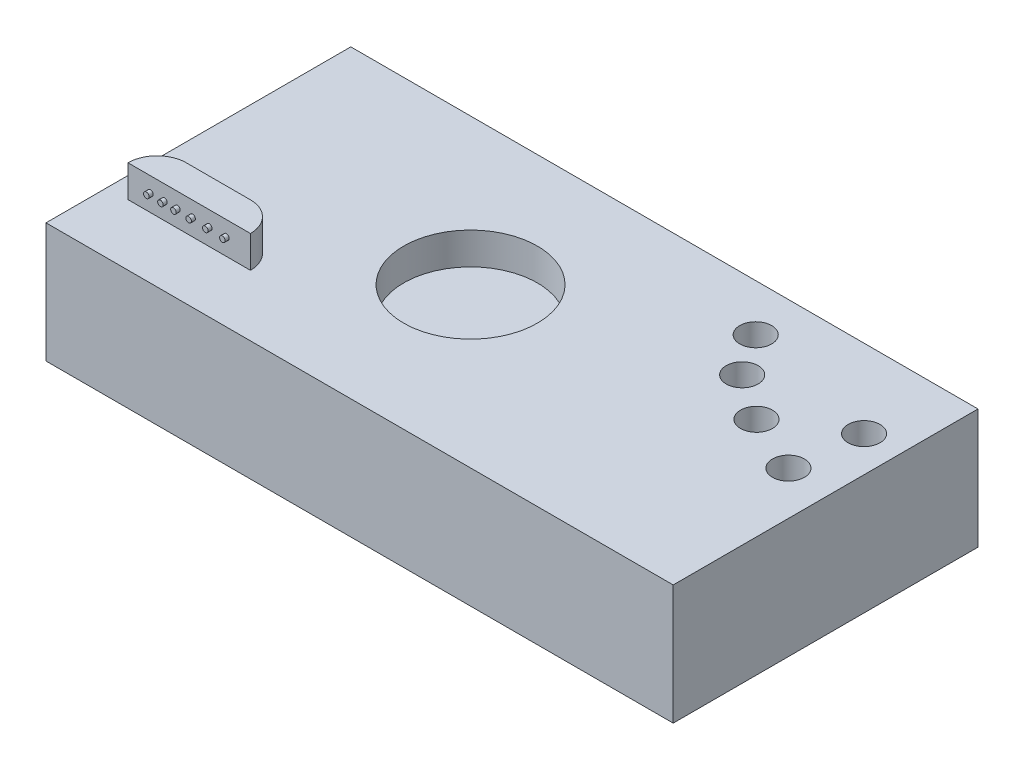
from build123d import *

# Parameters (mm, degrees)
SKETCH1_W           = 157.185890266
SKETCH1_H           = 76.388087763
BOSS_EXTRUDE1_DEPTH = 30
SKETCH2_R           = 4
SKETCH2_R_2         = 16.751919573
CUT_EXTRUDE1_DEPTH  = 8
BOSS_EXTRUDE5_DEPTH = 8
SKETCH8_R           = 0.7
BOSS_EXTRUDE6_DEPTH = 1


with BuildPart() as part:
    # Sketch1 → Boss-Extrude1 (new body)
    with BuildSketch(Plane(origin=(0, 0, 0), x_dir=(1, 0, 0), z_dir=(0, 1, 0))):
        with Locations((-65.664274203, 22.88675236)):
            Rectangle(SKETCH1_W, SKETCH1_H)
    extrude(amount=BOSS_EXTRUDE1_DEPTH)

    # Sketch2 → Cut-Extrude1 (cut)
    with BuildSketch(Plane(origin=(0, 30, 0), x_dir=(1, 0, 0), z_dir=(0, 1, 0))):
        with Locations((2.020364903, 24.483023403)):
            Circle(SKETCH2_R)
        with Locations((-12.582950978, 31.07817581)):
            Circle(SKETCH2_R)
        with Locations((-24.034725928, 38.939278582)):
            Circle(SKETCH2_R)
        with Locations((-31.0292801, 49.329254707)):
            Circle(SKETCH2_R)
        with Locations((4.005067314, 41.454528732)):
            Circle(SKETCH2_R)
        with Locations((-77.650582925, 24.483023403)):
            Circle(SKETCH2_R_2)
    extrude(amount=-CUT_EXTRUDE1_DEPTH, mode=Mode.SUBTRACT)

    # Sketch3 → Boss-Extrude5 (add)
    with BuildSketch(Plane(origin=(0, 30, 0), x_dir=(1, 0, 0), z_dir=(0, 1, 0))):
        with BuildLine():
            Line((-115.629013378, 7.30264293), (-131.71869807, 7.30264293))
            ThreePointArc((-131.71869807, 7.30264293), (-136.882446407, 5.163748337), (-139.021341, 0))
            Line((-139.021341, 0), (-108.326370448, 0))
            ThreePointArc((-108.326370448, 0), (-110.465265042, 5.163748337), (-115.629013378, 7.30264293))
        make_face()
    extrude(amount=BOSS_EXTRUDE5_DEPTH)

    # Sketch8 → Boss-Extrude6 (add)
    with BuildSketch(Plane.XY):
        with Locations((-133.40757623, 34.255602161)):
            Circle(SKETCH8_R)
        with Locations((-129.880481724, 34.255602161)):
            Circle(SKETCH8_R)
        with Locations((-126.621646944, 34.255602161)):
            Circle(SKETCH8_R)
        with Locations((-122.826292713, 34.255602161)):
            Circle(SKETCH8_R)
        with Locations((-118.643776602, 34.255602161)):
            Circle(SKETCH8_R)
        with Locations((-114.360631583, 34.255602161)):
            Circle(SKETCH8_R)
    extrude(amount=BOSS_EXTRUDE6_DEPTH)


solid = part.part
